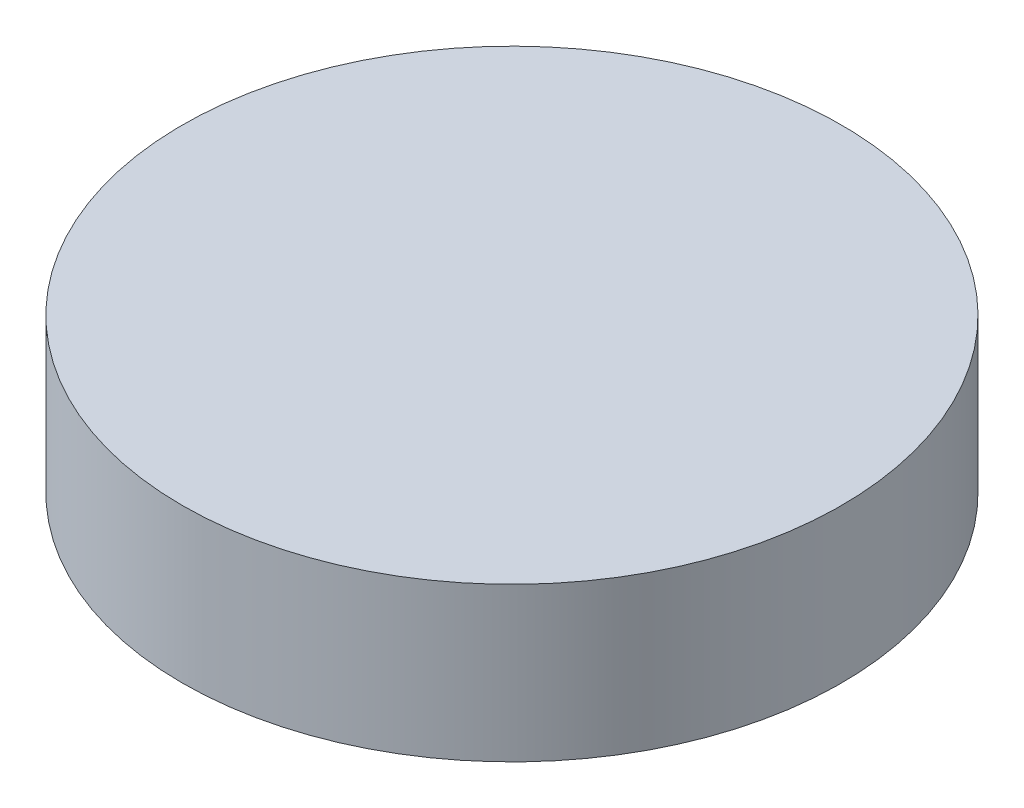
from build123d import *

# Parameters (mm, degrees)
SKETCH1_R           = 10.5
BOSS_EXTRUDE1_DEPTH = 4.9


with BuildPart() as part:
    # Sketch1 → Boss-Extrude1 (new body)
    with BuildSketch(Plane(origin=(0, 0, 0), x_dir=(1, 0, 0), z_dir=(0, 1, 0))):
        with Locations(Location((0, 0, 0), (0, 0, 270))):
            Circle(SKETCH1_R)
    extrude(amount=BOSS_EXTRUDE1_DEPTH)


solid = part.part
